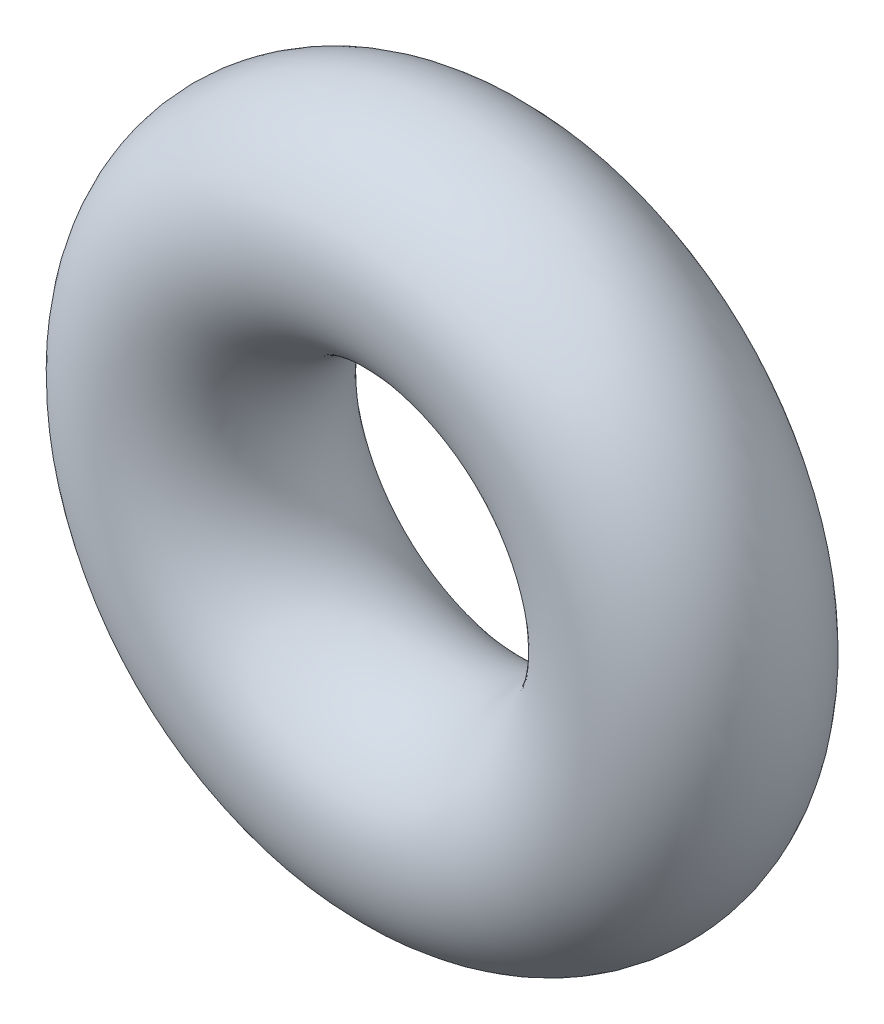
from build123d import *

# Parameters (mm, degrees)
SKETCH_2_R = 67.5


with BuildPart() as part:
    # 扫描1: sweep along a path in 草图1
    with BuildLine(Plane.XY) as sweep_1_path:
        CenterArc((0, 0), 148.75, 0, 360)
    # 草图2 → 扫描1 (sweep)
    with BuildSketch(Plane(origin=(0, 0, 0), x_dir=(1, 0, 0), z_dir=(0, 1, 0))):
        with Locations((-148.75, 0)):
            Circle(SKETCH_2_R)
    sweep(path=sweep_1_path.line)


solid = part.part
